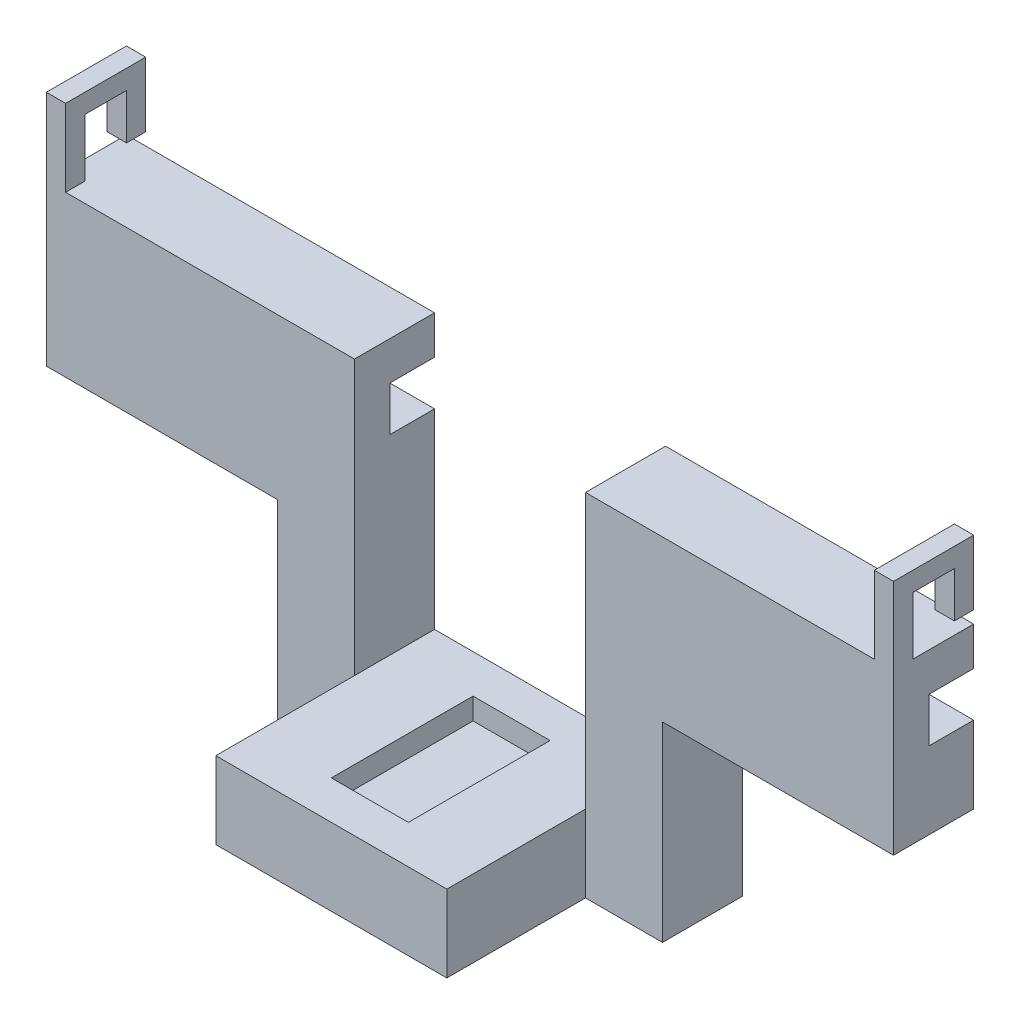
from build123d import *

# Parameters (mm, degrees)
SKETCH1_W           = 139.7
SKETCH1_H           = 66.04
BOSS_EXTRUDE1_DEPTH = 13.208
SKETCH2_W           = 38.1
SKETCH2_H           = 53.34
CUT_EXTRUDE1_DEPTH  = 13.208
SKETCH3_W           = 38.1
SKETCH3_H           = 12.7
BOSS_EXTRUDE2_DEPTH = 31.242
SKETCH4_W           = 12.7
SKETCH4_H           = 23.368
CUT_EXTRUDE2_DEPTH  = 3.556
SKETCH5_W           = 17.018
SKETCH5_H           = 22.606
SKETCH5_W_2         = 4.318
SKETCH5_H_2         = 10.414
BOSS_EXTRUDE3_DEPTH = 9.525
SKETCH6_W           = 7.366
SKETCH6_H           = 7.366
SKETCH6_W_2         = 13.208
SKETCH6_H_2         = 8.128
CUT_EXTRUDE3_DEPTH  = 172.847
BOSS_EXTRUDE4_DEPTH = 139.7
SKETCH8_W           = 133.35
SKETCH8_H           = 12.7
CUT_EXTRUDE4_DEPTH  = 139.7
SKETCH9_W           = 38.1
SKETCH9_H           = 31.496
CUT_EXTRUDE5_DEPTH  = 139.7
SKETCH10_W          = 38.1
SKETCH10_H          = 8.382
CUT_EXTRUDE6_DEPTH  = 139.7


with BuildPart() as part:
    # Sketch1 → Boss-Extrude1 (new body)
    with BuildSketch(Plane.XY):
        with Locations((69.85, 33.02)):
            Rectangle(SKETCH1_W, SKETCH1_H)
    extrude(amount=BOSS_EXTRUDE1_DEPTH)

    # Sketch2 → Cut-Extrude1 (cut)
    with BuildSketch(Plane.XY.offset(13.208)):
        with Locations((69.85, 39.37)):
            Rectangle(SKETCH2_W, SKETCH2_H)
    extrude(amount=-CUT_EXTRUDE1_DEPTH, mode=Mode.SUBTRACT)

    # Sketch3 → Boss-Extrude2 (add)
    with BuildSketch(Plane.XY.offset(13.208)):
        with Locations((69.85, 6.35)):
            Rectangle(SKETCH3_W, SKETCH3_H)
    extrude(amount=BOSS_EXTRUDE2_DEPTH)

    # Sketch4 → Cut-Extrude2 (cut)
    with BuildSketch(Plane(origin=(0, 12.7, 0), x_dir=(1, 0, 0), z_dir=(0, 1, 0))):
        with Locations((69.85, -18.034)):
            Rectangle(SKETCH4_W, SKETCH4_H)
    extrude(amount=-CUT_EXTRUDE2_DEPTH, mode=Mode.SUBTRACT)

    # Sketch5 → Boss-Extrude3 (add)
    with BuildSketch(Plane.XZ):
        with Locations((69.85, 11.303)):
            Rectangle(SKETCH5_W, SKETCH5_H)
        with Locations((69.85, 11.557)):
            Rectangle(SKETCH5_W_2, SKETCH5_H_2, mode=Mode.SUBTRACT)
    extrude(amount=BOSS_EXTRUDE3_DEPTH)

    # Sketch6 → Cut-Extrude3 (cut)
    with BuildSketch(Plane(origin=(139.7, 0, 0), x_dir=(0, 0, -1), z_dir=(1, 0, 0))):
        with Locations((-3.683, 47.879)):
            Rectangle(SKETCH6_W, SKETCH6_H)
        with Locations((-6.604, 61.976)):
            Rectangle(SKETCH6_W_2, SKETCH6_H_2)
    extrude(amount=-CUT_EXTRUDE3_DEPTH, mode=Mode.SUBTRACT)

    # Sketch7 → Boss-Extrude4 (add)
    with BuildSketch(Plane.ZY):
        Polygon((0, 59.944), (0, 70.612), (13.208, 70.612), (13.208, 59.944), (13.208, 57.912), (10.033, 57.912), (10.033, 59.944), (10.033, 67.437), (3.175, 67.437), (3.175, 59.944), align=None)
    extrude(amount=-BOSS_EXTRUDE4_DEPTH)

    # Sketch8 → Cut-Extrude4 (cut)
    with BuildSketch(Plane.XY.offset(13.208)):
        with Locations((69.85, 64.262)):
            Rectangle(SKETCH8_W, SKETCH8_H)
    extrude(amount=-CUT_EXTRUDE4_DEPTH, mode=Mode.SUBTRACT)

    # Sketch9 → Cut-Extrude5 (cut)
    with BuildSketch(Plane(origin=(0, 0, 0), x_dir=(-1, 0, 0), z_dir=(0, 0, -1))):
        with Locations((-120.65, 15.748)):
            Rectangle(SKETCH9_W, SKETCH9_H)
        with Locations((-19.05, 15.748)):
            Rectangle(SKETCH9_W, SKETCH9_H)
    extrude(amount=-CUT_EXTRUDE5_DEPTH, mode=Mode.SUBTRACT)

    # Sketch10 → Cut-Extrude6 (cut)
    with BuildSketch(Plane(origin=(0, 12.7, 0), x_dir=(1, 0, 0), z_dir=(0, 1, 0))):
        with Locations((69.85, -40.259)):
            Rectangle(SKETCH10_W, SKETCH10_H)
    extrude(amount=-CUT_EXTRUDE6_DEPTH, mode=Mode.SUBTRACT)


solid = part.part
